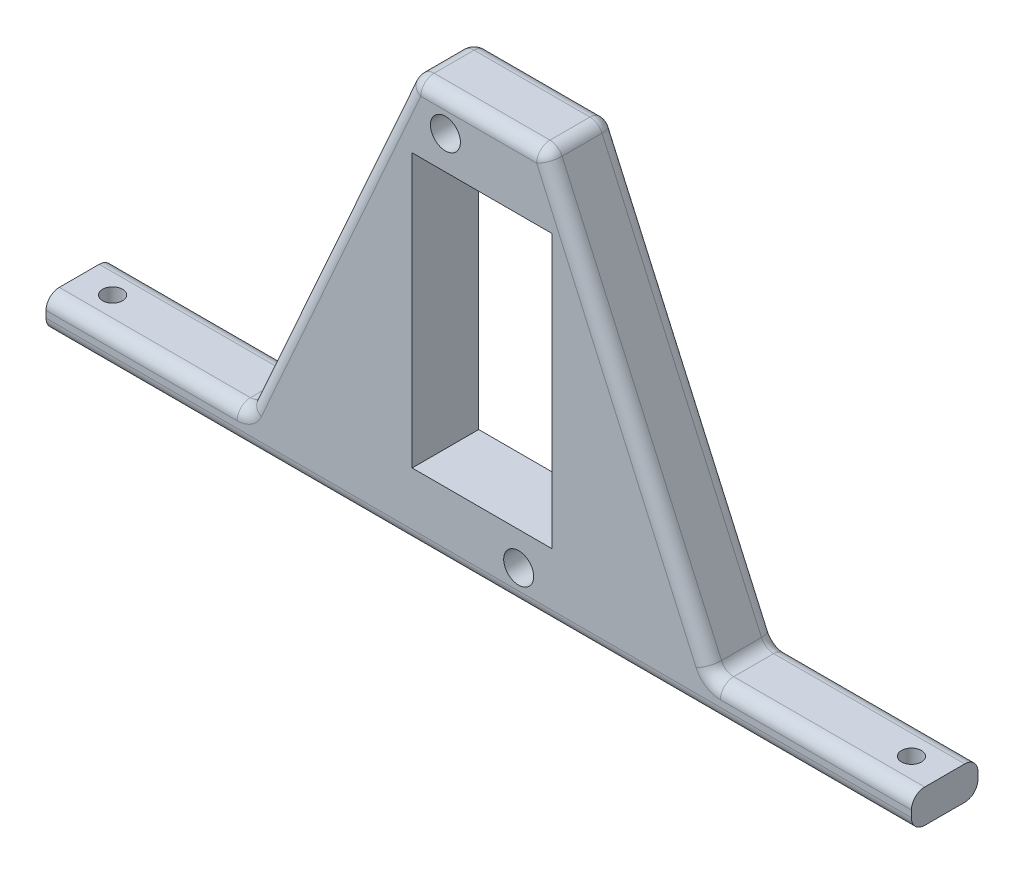
from build123d import *

# Parameters (mm, degrees)
SKETCH1_W           = 21
SKETCH1_H           = 41
BOSS_EXTRUDE1_DEPTH = 10
SKETCH1_3_R         = 2.25
CUT_EXTRUDE1_DEPTH  = 10
SKETCH2_R           = 1.5
CUT_EXTRUDE2_DEPTH  = 5
FILLET1_R           = 2
FILLET2_R           = 2


with BuildPart() as part:
    # Sketch1 → Boss-Extrude1 (new body)
    with BuildSketch(Plane.XY):
        Polygon((8.094892468, -32.802015288), (-16.905107532, 23.197984712), (-36.905107532, 23.197984712), (-61.905107532, -32.802015288), (-91.905107532, -32.802015288), (-91.905107532, -37.802015288), (38.094892468, -37.802015288), (38.094892468, -32.802015288), align=None)
        with Locations((-26.405107532, -7.302015288)):
            Rectangle(SKETCH1_W, SKETCH1_H, mode=Mode.SUBTRACT)
    extrude(amount=BOSS_EXTRUDE1_DEPTH)

    # Sketch1<3> → Cut-Extrude1 (cut)
    with BuildSketch(Plane.XY):
        with Locations((-31.905107532, 18.197984712)):
            Circle(SKETCH1_3_R)
        with Locations((-20.905107532, -32.802015288)):
            Circle(SKETCH1_3_R)
    extrude(amount=CUT_EXTRUDE1_DEPTH, mode=Mode.SUBTRACT)

    # Sketch2 → Cut-Extrude2 (cut)
    with BuildSketch(Plane(origin=(0, -32.802015288, 0), x_dir=(1, 0, 0), z_dir=(0, 1, 0))):
        with Locations((33.094892468, -5)):
            Circle(SKETCH2_R)
        with Locations((-86.905107532, -5)):
            Circle(SKETCH2_R)
    extrude(amount=-CUT_EXTRUDE2_DEPTH, mode=Mode.SUBTRACT)

    # Fillet1
    fillet1_edges = [part.edges().sort_by_distance(p)[0] for p in [
        (-61.905107532, -32.802015288, 5),
        (8.094892468, -32.802015288, 5),
        (-36.905107532, 23.197984712, 5),
        (-16.905107532, 23.197984712, 5),
    ]]
    fillet(fillet1_edges, radius=FILLET1_R)

    # Fillet2
    fillet2_edges = [part.edges().sort_by_distance(p)[0] for p in [
        (23.743588762, -32.802015288, 0),
        (8.303846577, -32.479901363, 0),
        (-77.553803825, -32.802015288, 0),
        (-62.114061641, -32.479901363, 0),
        (-49.405107532, -4.802015288, 0),
        (-36.696153423, 22.875870787, 0),
        (-26.905107532, 23.197984712, 0),
        (-17.114061641, 22.875870787, 0),
        (23.743588762, -32.802015288, 10),
        (8.303846577, -32.479901363, 10),
        (-77.553803825, -32.802015288, 10),
        (-62.114061641, -32.479901363, 10),
        (-49.405107532, -4.802015288, 10),
        (-36.696153423, 22.875870787, 10),
        (-26.905107532, 23.197984712, 10),
        (-17.114061641, 22.875870787, 10),
        (-26.905107532, -37.802015288, 10),
        (-26.905107532, -37.802015288, 0),
        (-4.405107532, -4.802015288, 0),
        (-4.405107532, -4.802015288, 10),
    ]]
    fillet(fillet2_edges, radius=FILLET2_R)


solid = part.part
